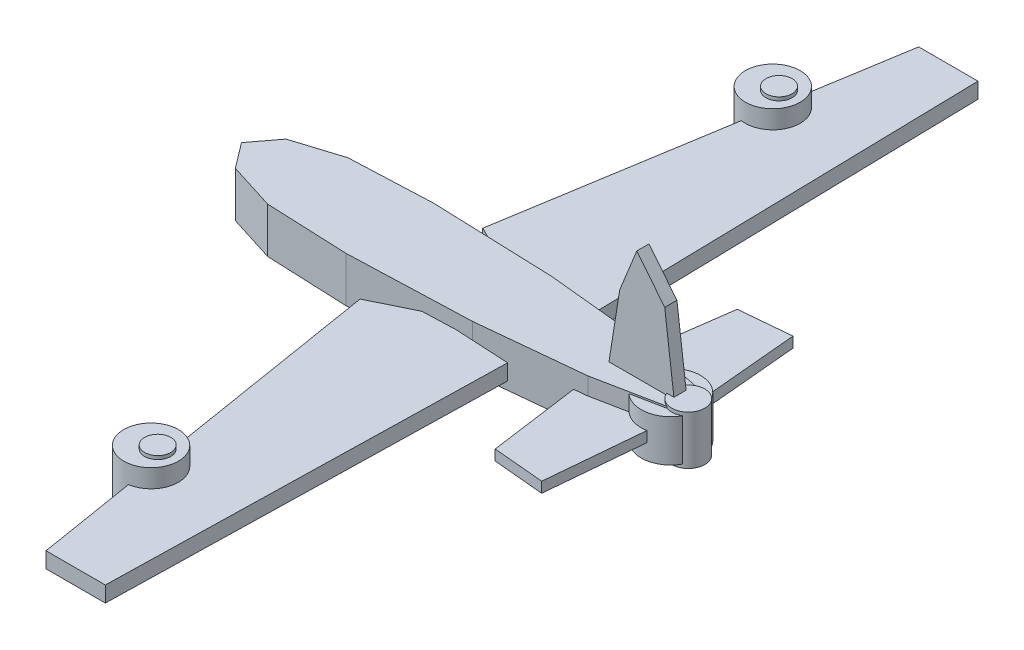
from build123d import *

# Parameters (mm, degrees)
BOSS_EXTRUDE1_DEPTH  = 130
BOSS_EXTRUDE2_DEPTH  = 45
BOSS_EXTRUDE3_DEPTH  = 45
BOSS_EXTRUDE4_DEPTH  = 30
BOSS_EXTRUDE5_DEPTH  = 30
BOSS_EXTRUDE6_DEPTH  = 35
SKETCH7_R            = 156.819911707
BOSS_EXTRUDE7_DEPTH  = 150
SKETCH8_R            = 156.819911707
BOSS_EXTRUDE8_DEPTH  = 150
SKETCH9_R            = 170
BOSS_EXTRUDE9_DEPTH  = 120
SKETCH10_R           = 75
BOSS_EXTRUDE10_DEPTH = 170
SKETCH11_R           = 75
BOSS_EXTRUDE11_DEPTH = 170
SKETCH12_R           = 95
BOSS_EXTRUDE12_DEPTH = 140
SKETCH13_R           = 125
BOSS_EXTRUDE13_DEPTH = 45


with BuildPart() as part:
    # Sketch1 → Boss-Extrude1 (new, symmetric)
    with BuildSketch(Plane(origin=(0, 0, 0), x_dir=(1, 0, 0), z_dir=(0, 1, 0))):
        Polygon((-1300, 0), (-1190, 145), (-920, 230), (-450, 250), (250, 225), (850, 165), (1250, 85), (1300, 0), (1250, -85), (850, -165), (250, -225), (-450, -250), (-920, -230), (-1190, -145), align=None)
    extrude(amount=BOSS_EXTRUDE1_DEPTH, both=True)


with BuildPart() as body_2:
    # Sketch2 → Boss-Extrude2 (new, symmetric)
    with BuildSketch(Plane(origin=(0, 0, 0), x_dir=(1, 0, 0), z_dir=(0, 1, 0))):
        Polygon((0, 220), (470, 245), (420, 2500), (80, 2500), (-180, 900), (-269.133810321, 351.484244177), align=None)
    extrude(amount=BOSS_EXTRUDE2_DEPTH, both=True)


with BuildPart() as body_3:
    # Sketch3 → Boss-Extrude3 (new, symmetric)
    with BuildSketch(Plane(origin=(0, 0, 0), x_dir=(1, 0, 0), z_dir=(0, 1, 0))):
        Polygon((0, -220), (470, -245), (420, -2500), (80, -2500), (-180, -900), (-269.133810321, -351.484244177), align=None)
    extrude(amount=BOSS_EXTRUDE3_DEPTH, both=True)


with BuildPart() as body_4:
    # Sketch4 → Boss-Extrude4 (new, symmetric)
    with BuildSketch(Plane(origin=(0, 0, 0), x_dir=(1, 0, 0), z_dir=(0, 1, 0))):
        Polygon((760, 60), (1200, 60), (1140, 720), (846.967213115, 693.360655738), align=None)
    extrude(amount=BOSS_EXTRUDE4_DEPTH, both=True)


with BuildPart() as body_5:
    # Sketch5 → Boss-Extrude5 (new, symmetric)
    with BuildSketch(Plane(origin=(0, 0, 0), x_dir=(1, 0, 0), z_dir=(0, 1, 0))):
        Polygon((760, -60), (1200, -60), (1140, -720), (846.967213115, -693.360655738), align=None)
    extrude(amount=BOSS_EXTRUDE5_DEPTH, both=True)


with BuildPart() as body_6:
    # Sketch6 → Boss-Extrude6 (new, symmetric)
    with BuildSketch(Plane.XY):
        Polygon((820, 0), (1230, 0), (1160, 560), (1000, 760), (901.951219512, 517.56097561), align=None)
    extrude(amount=BOSS_EXTRUDE6_DEPTH, both=True)


with BuildPart() as body_7:
    # Sketch7 → Boss-Extrude7 (new, symmetric)
    with BuildSketch(Plane(origin=(0, 0, 0), x_dir=(1, 0, 0), z_dir=(0, 1, 0))):
        with Locations(Location((-36.819911707, 1781.108235652, 0), (0, 0, 270))):
            Circle(SKETCH7_R)
    extrude(amount=BOSS_EXTRUDE7_DEPTH, both=True)


with BuildPart() as body_8:
    # Sketch8 → Boss-Extrude8 (new, symmetric)
    with BuildSketch(Plane(origin=(0, 0, 0), x_dir=(1, 0, 0), z_dir=(0, 1, 0))):
        with Locations(Location((-36.819911707, -1781.108235652, 0), (0, 0, 270))):
            Circle(SKETCH8_R)
    extrude(amount=BOSS_EXTRUDE8_DEPTH, both=True)


with BuildPart() as body_9:
    # Sketch9 → Boss-Extrude9 (new, symmetric)
    with BuildSketch(Plane(origin=(0, 0, 0), x_dir=(1, 0, 0), z_dir=(0, 1, 0))):
        with Locations(Location((1160, 0, 0), (0, 0, 270))):
            Circle(SKETCH9_R)
    extrude(amount=BOSS_EXTRUDE9_DEPTH, both=True)


with BuildPart() as body_10:
    # Sketch10 → Boss-Extrude10 (new, symmetric)
    with BuildSketch(Plane(origin=(0, 0, 0), x_dir=(1, 0, 0), z_dir=(0, 1, 0))):
        with Locations(Location((0, 1780, 0), (0, 0, 270))):
            Circle(SKETCH10_R)
    extrude(amount=BOSS_EXTRUDE10_DEPTH, both=True)


with BuildPart() as body_11:
    # Sketch11 → Boss-Extrude11 (new, symmetric)
    with BuildSketch(Plane(origin=(0, 0, 0), x_dir=(1, 0, 0), z_dir=(0, 1, 0))):
        with Locations(Location((0, -1780, 0), (0, 0, 270))):
            Circle(SKETCH11_R)
    extrude(amount=BOSS_EXTRUDE11_DEPTH, both=True)


with BuildPart() as body_12:
    # Sketch12 → Boss-Extrude12 (new, symmetric)
    with BuildSketch(Plane(origin=(0, 0, 0), x_dir=(1, 0, 0), z_dir=(0, 1, 0))):
        with Locations(Location((1260, 0, 0), (0, 0, 270))):
            Circle(SKETCH12_R)
    extrude(amount=BOSS_EXTRUDE12_DEPTH, both=True)


with BuildPart() as body_13:
    # Sketch13 → Boss-Extrude13 (new, symmetric)
    with BuildSketch(Plane(origin=(0, 0, 0), x_dir=(1, 0, 0), z_dir=(0, 1, 0))):
        with Locations(Location((-1080, 0, 0), (0, 0, 90))):
            Circle(SKETCH13_R)
    extrude(amount=BOSS_EXTRUDE13_DEPTH, both=True)


solid = Compound([part.part, body_2.part, body_3.part, body_4.part, body_5.part, body_6.part, body_7.part, body_8.part, body_9.part, body_10.part, body_11.part, body_12.part, body_13.part])
